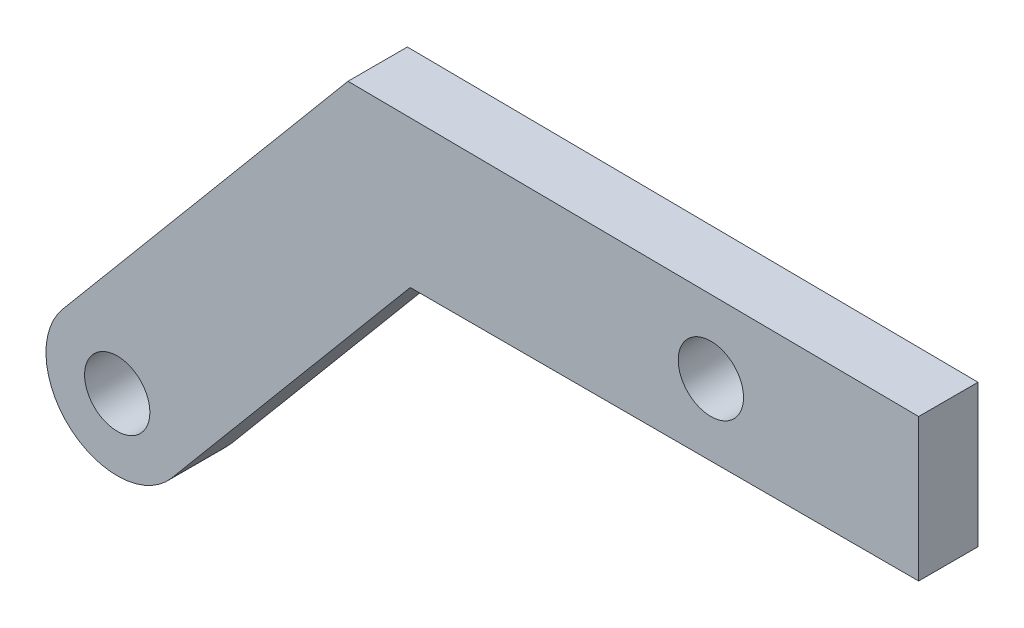
from build123d import *

# Parameters (mm, degrees)
SKETCH1_R           = 5.5
BOSS_EXTRUDE1_DEPTH = 10


with BuildPart() as part:
    # Sketch1 → Boss-Extrude1 (new body)
    with BuildSketch(Plane.XY):
        with BuildLine():
            Line((9.192533317, -7.713451316), (39.711607161, 28.65776458))
            Line((39.711607161, 28.65776458), (49.357211477, 40.152948176))
            Line((49.357211477, 40.152948176), (135, 40.152948176))
            Line((135, 40.152948176), (135, 64.152948176))
            Line((135, 64.152948176), (38.876588555, 65))
            Line((38.876588555, 65), (-9.192533317, 7.713451316))
            ThreePointArc((-9.192533317, 7.713451316), (-7.713451316, -9.192533317), (9.192533317, -7.713451316))
        make_face()
        Circle(SKETCH1_R, mode=Mode.SUBTRACT)
        with Locations((100, 52.152948176)):
            Circle(SKETCH1_R, mode=Mode.SUBTRACT)
    extrude(amount=BOSS_EXTRUDE1_DEPTH)


solid = part.part
